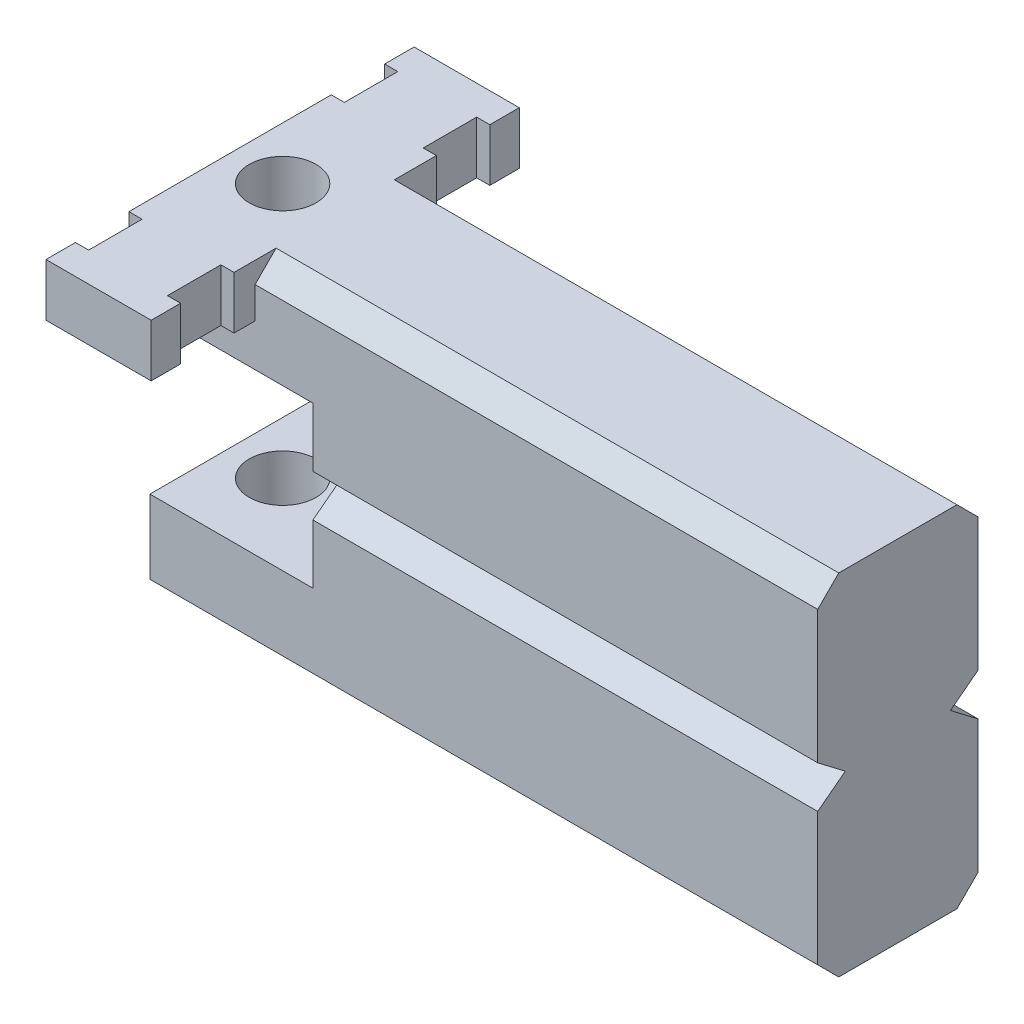
from build123d import *

# Parameters (mm, degrees)
BOSS_EXTRUDE1_DEPTH = 63.5
CHAMFER1_SIZE       = 2
BOSS_EXTRUDE2_DEPTH = 5
SKETCH5_R           = 3.175
CUT_EXTRUDE3_DEPTH  = 76.963303483
SKETCH6_R           = 3.175
CUT_EXTRUDE4_DEPTH  = 7.62


with BuildPart() as part:
    # Sketch1 → Boss-Extrude1 (new body)
    with BuildSketch(Plane(origin=(0, 0, 0), x_dir=(0, 0, -1), z_dir=(1, 0, 0))):
        Polygon((0, 0), (15.24, 0), (15.24, 14.637), (12.62, 16.637), (15.24, 18.637), (15.24, 33.274), (0, 33.274), (0, 18.637), (2.62, 16.637), (0, 14.637), align=None)
    extrude(amount=BOSS_EXTRUDE1_DEPTH)

    # Chamfer1
    chamfer1_edges = [part.edges().sort_by_distance(p)[0] for p in [
        (31.75, 33.274, 0),
        (31.75, 33.274, -15.24),
        (31.75, 0, -15.24),
        (31.75, 0, 0),
    ]]
    chamfer(chamfer1_edges, length=CHAMFER1_SIZE)

    # Sketch4 → Boss-Extrude2 (add)
    with BuildSketch(Plane(origin=(0, 33.274, 0), x_dir=(1, 0, 0), z_dir=(0, 1, 0))):
        Polygon((10, 25.12), (0, 25.12), (0, 22.32), (1.25, 22.32), (1.25, 17.24), (0, 17.24), (0, -2), (1.25, -2), (1.25, -7.08), (0, -7.08), (0, -9.88), (10, -9.88), (10, -7.08), (8.75, -7.08), (8.75, -2), (10, -2), (10, 17.24), (8.75, 17.24), (8.75, 22.32), (10, 22.32), align=None)
    extrude(amount=-BOSS_EXTRUDE2_DEPTH)

    # Sketch5 → Cut-Extrude3 (cut, through all)
    with BuildSketch(Plane(origin=(0, 33.274, 0), x_dir=(1, 0, 0), z_dir=(0, 1, 0))):
        with Locations(Location((5, 7.62, 0), (0, 0, 270))):
            Circle(SKETCH5_R)
    extrude(amount=-CUT_EXTRUDE3_DEPTH, mode=Mode.SUBTRACT)

    # Sketch6 → Cut-Extrude4 (cut, symmetric)
    # profile 1 of 3: a face of its own
    with BuildSketch(Plane(origin=(0, 16.637, 0), x_dir=(-1, 0, 0), z_dir=(0, -1, 0))):
        with BuildLine():
            ThreePointArc((-15.5, 7.620000044), (-12.424621187, 15.044621218), (-5, 18.12))
            Line((-5, 18.12), (-15.5, 18.12))
            Line((-15.5, 18.12), (-15.5, 7.620000044))
        make_face()
    # profile 2 of 3: a face of its own
    with BuildSketch(Plane(origin=(0, 16.637, 0), x_dir=(-1, 0, 0), z_dir=(0, -1, 0))):
        with BuildLine():
            Line((5.5, 18.12), (-5, 18.12))
            ThreePointArc((-5, 18.12), (-12.424621187, 15.044621218), (-15.5, 7.620000044))
            ThreePointArc((-15.5, 7.620000044), (-12.424621218, 0.195378813), (-5, -2.88))
            Line((-5, -2.88), (5.5, -2.88))
            Line((5.5, -2.88), (5.5, 18.12))
        make_face()
        with Locations(Location((-5, 7.62, 0), (0, 0, 270))):
            Circle(SKETCH6_R, mode=Mode.SUBTRACT)
    # profile 3 of 3: a face of its own
    with BuildSketch(Plane(origin=(0, 16.637, 0), x_dir=(-1, 0, 0), z_dir=(0, -1, 0))):
        with BuildLine():
            ThreePointArc((-5, -2.88), (-12.424621218, 0.195378813), (-15.5, 7.620000044))
            Line((-15.5, 7.620000044), (-15.5, -2.88))
            Line((-15.5, -2.88), (-5, -2.88))
        make_face()
    extrude(amount=CUT_EXTRUDE4_DEPTH, both=True, mode=Mode.SUBTRACT)


solid = part.part
